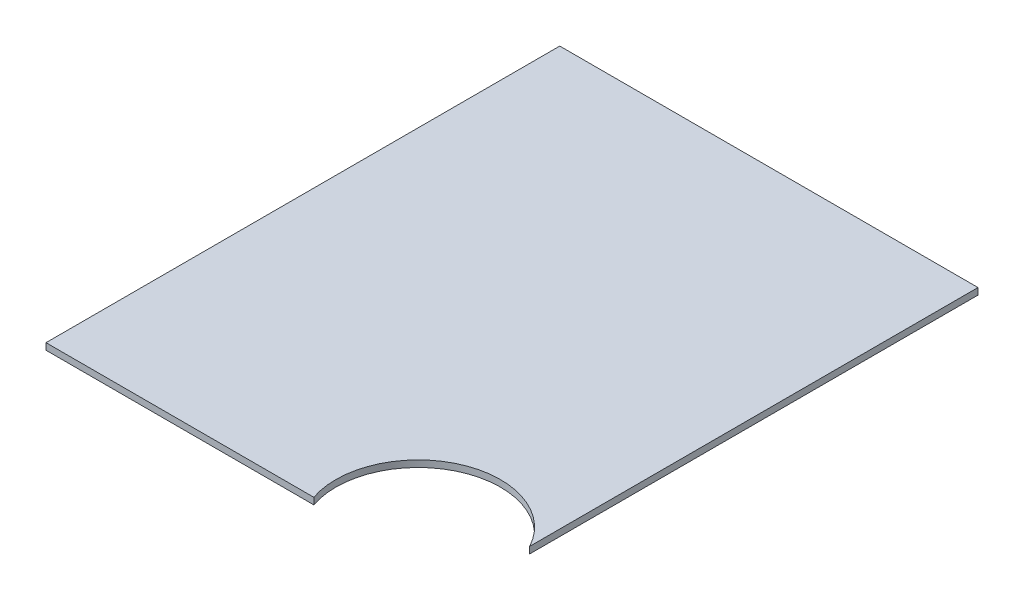
from build123d import *

# Parameters (mm, degrees)
SKETCH1_W           = 127
SKETCH1_H           = 156
BOSS_EXTRUDE1_DEPTH = 2
SKETCH2_R           = 25
CUT_EXTRUDE1_DEPTH  = 2


with BuildPart() as part:
    # Sketch1 → Boss-Extrude1 (new body)
    with BuildSketch(Plane(origin=(0, 0, 0), x_dir=(1, 0, 0), z_dir=(0, 1, 0))):
        Rectangle(SKETCH1_W, SKETCH1_H)
    extrude(amount=BOSS_EXTRUDE1_DEPTH)

    # Sketch2 → Cut-Extrude1 (cut)
    with BuildSketch(Plane(origin=(0, 2, 0), x_dir=(1, 0, 0), z_dir=(0, 1, 0))):
        with Locations((41.5, -70)):
            Circle(SKETCH2_R)
    extrude(amount=-CUT_EXTRUDE1_DEPTH, mode=Mode.SUBTRACT)


solid = part.part
